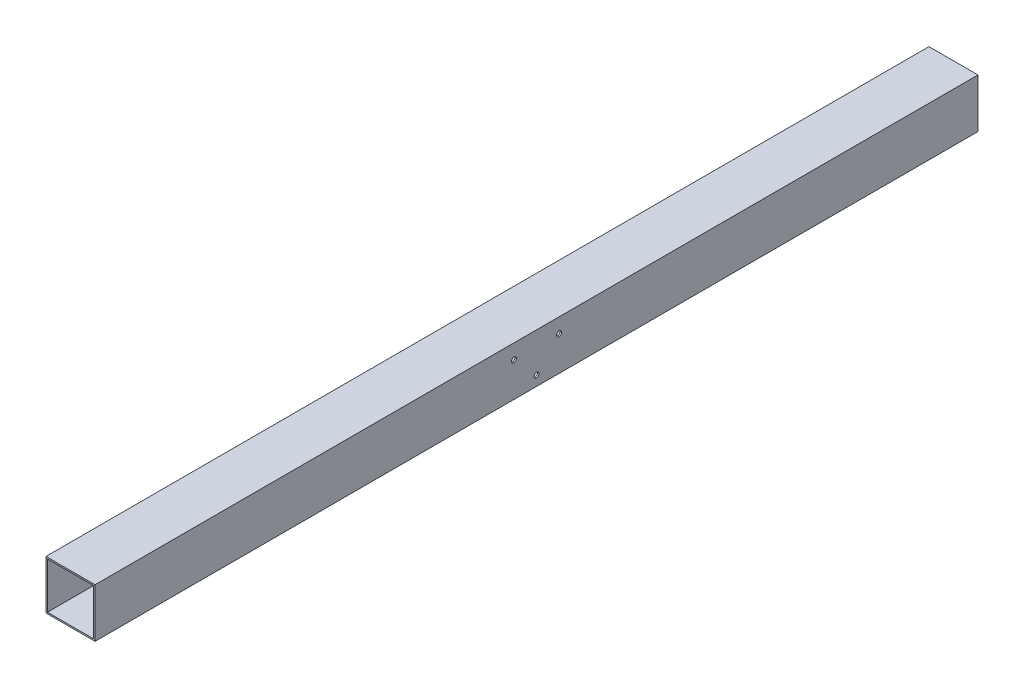
from build123d import *

# Parameters (mm, degrees)
SKETCH1_W           = 50
SKETCH1_H           = 50
SKETCH1_W_2         = 47
SKETCH1_H_2         = 47
BOSS_EXTRUDE1_DEPTH = 900
SKETCH2_R           = 2.5
CUT_EXTRUDE1_DEPTH  = 59


with BuildPart() as part:
    # Sketch1 → Boss-Extrude1 (new body)
    with BuildSketch(Plane.XY):
        Rectangle(SKETCH1_W, SKETCH1_H)
        Rectangle(SKETCH1_W_2, SKETCH1_H_2, mode=Mode.SUBTRACT)
    extrude(amount=BOSS_EXTRUDE1_DEPTH)

    # Sketch2 → Cut-Extrude1 (cut)
    with BuildSketch(Plane(origin=(25, 0, 0), x_dir=(0, 0, -1), z_dir=(1, 0, 0))):
        with Locations(Location((-450, -15, 0), (0, 0, 90))):
            Circle(SKETCH2_R)
        with Locations(Location((-427, 10, 0), (0, 0, 90))):
            Circle(SKETCH2_R)
        with Locations(Location((-473, 10, 0), (0, 0, 90))):
            Circle(SKETCH2_R)
    extrude(amount=-CUT_EXTRUDE1_DEPTH, mode=Mode.SUBTRACT)


solid = part.part
